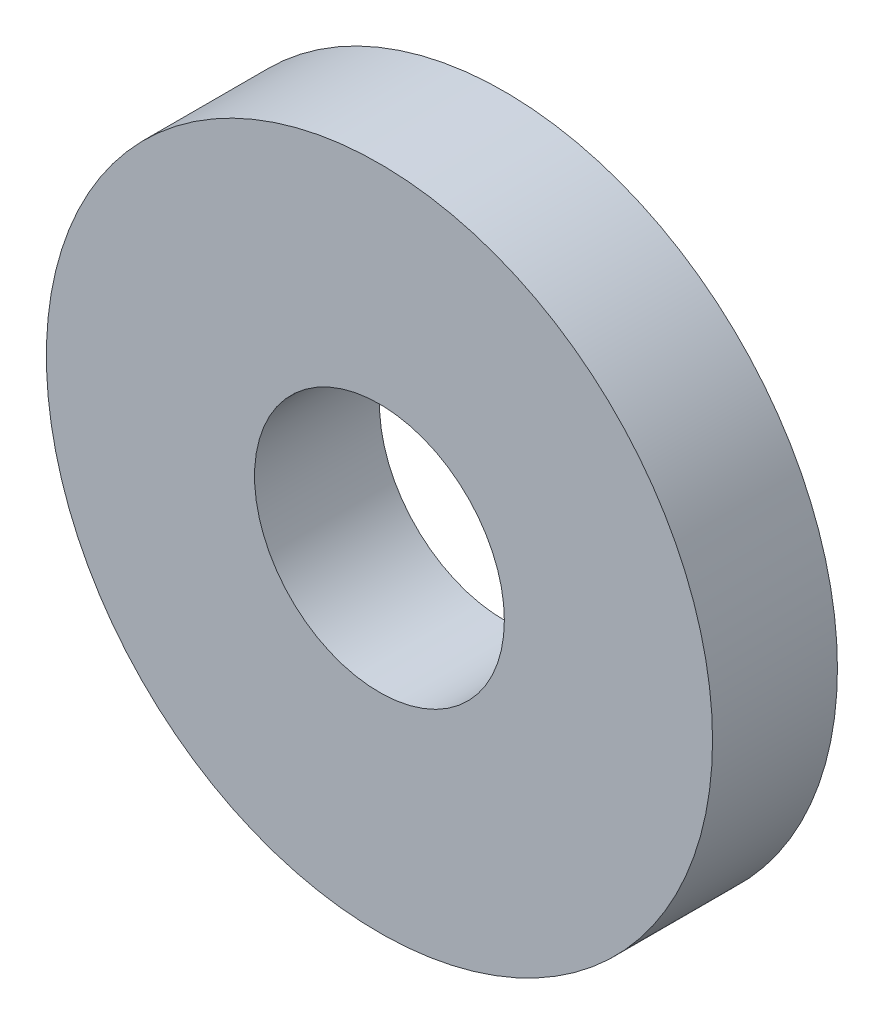
from build123d import *

# Parameters (mm, degrees)
SKETCH1_R           = 32
SKETCH1_R_2         = 12
BOSS_EXTRUDE1_DEPTH = 12


with BuildPart() as part:
    # Sketch1 → Boss-Extrude1 (new body)
    with BuildSketch(Plane.XY):
        Circle(SKETCH1_R)
        Circle(SKETCH1_R_2, mode=Mode.SUBTRACT)
    extrude(amount=BOSS_EXTRUDE1_DEPTH)


solid = part.part
